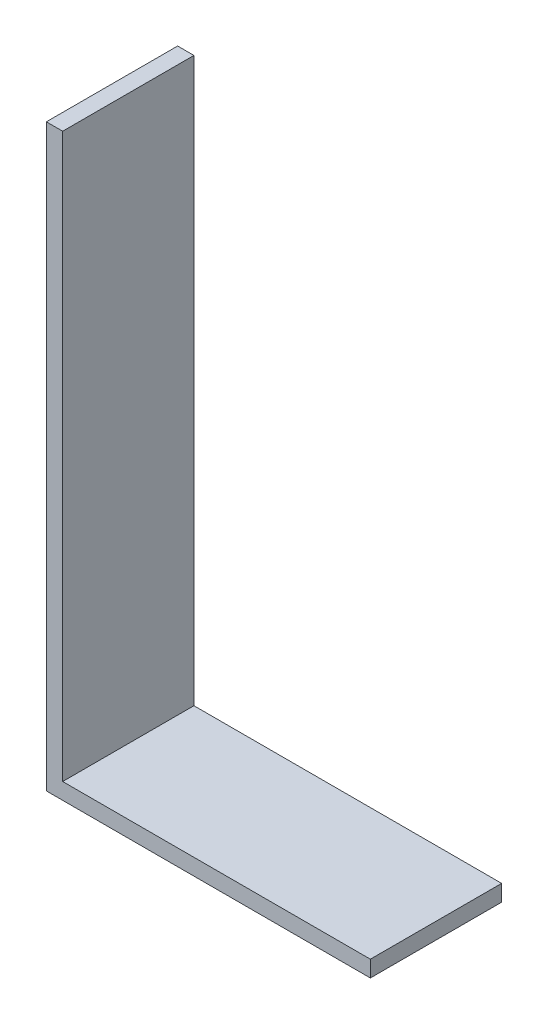
from build123d import *

# Parameters (mm, degrees)
SALIENTE_EXTRUIR1_DEPTH = 50.8


with BuildPart() as part:
    # Croquis1 → Saliente-Extruir1 (new body)
    with BuildSketch(Plane.XY):
        Polygon((125.365, 6.31), (125.365, 0), (0, 0), (0, 224.21628726), (6.31, 224.21628726), (6.31, 6.31), align=None)
    extrude(amount=SALIENTE_EXTRUIR1_DEPTH)


solid = part.part
